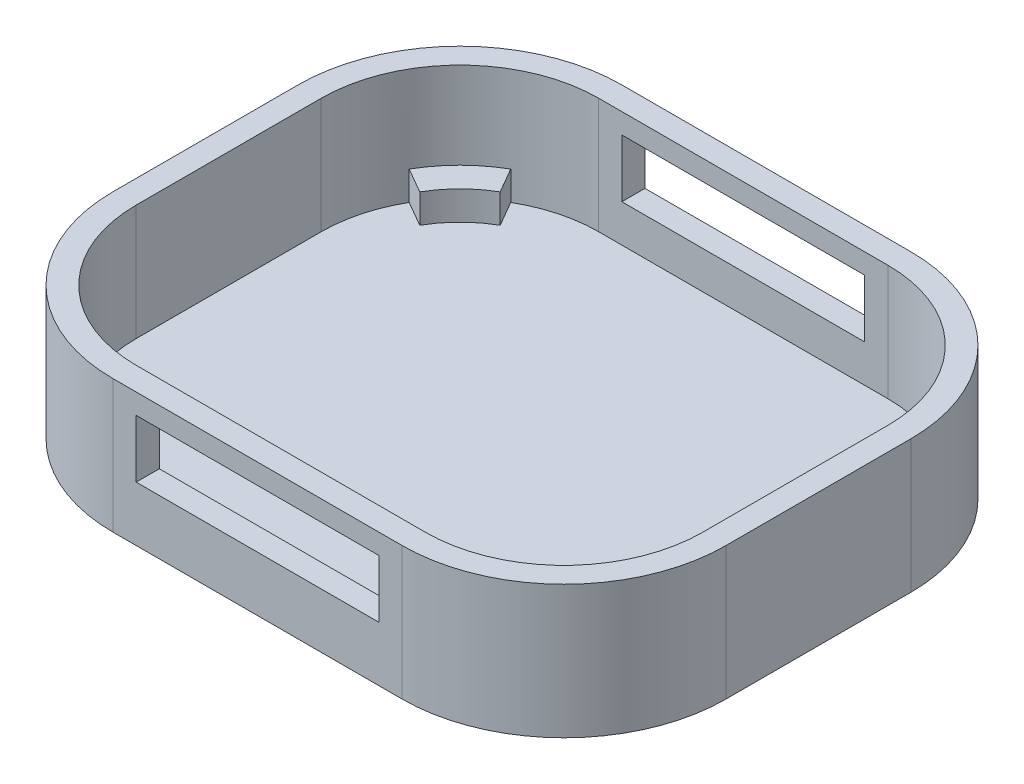
from build123d import *

# Parameters (mm, degrees)
BOSS_EXTRUDE1_DEPTH     = 5.75
CUT_EXTRUDE1_DEPTH      = 50.993124527
CUT_EXTRUDE1_DEPTH_BACK = 50.993124527
SKETCH2_W               = 21
SKETCH2_H               = 5
BOSS_EXTRUDE2_START     = -1.5
BOSS_EXTRUDE2_DEPTH     = 1.5
BOSS_EXTRUDE3_START     = 2.5
BOSS_EXTRUDE3_DEPTH     = 2.5


with BuildPart() as part:
    # Sketch1 → Boss-Extrude1 (new, symmetric)
    with BuildSketch(Plane(origin=(0, 0, 0), x_dir=(1, 0, 0), z_dir=(0, 1, 0))):
        with BuildLine():
            Line((-26.5, 8), (-26.5, -8))
            ThreePointArc((-26.5, -8), (-22.399494937, -17.899494937), (-12.5, -22))
            Line((-12.5, -22), (12.5, -22))
            ThreePointArc((12.5, -22), (22.399494937, -17.899494937), (26.5, -8))
            Line((26.5, -8), (26.5, 8))
            ThreePointArc((26.5, 8), (22.399494937, 17.899494937), (12.5, 22))
            Line((12.5, 22), (-12.5, 22))
            ThreePointArc((-12.5, 22), (-22.399494937, 17.899494937), (-26.5, 8))
        make_face()
        with BuildLine():
            Line((12.5, -20), (-12.5, -20))
            ThreePointArc((-12.5, -20), (-20.985281374, -16.485281374), (-24.5, -8))
            Line((-24.5, -8), (-24.5, 8))
            ThreePointArc((-24.5, 8), (-20.985281374, 16.485281374), (-12.5, 20))
            Line((-12.5, 20), (12.5, 20))
            ThreePointArc((12.5, 20), (20.985281374, 16.485281374), (24.5, 8))
            Line((24.5, 8), (24.5, -8))
            ThreePointArc((24.5, -8), (20.985281374, -16.485281374), (12.5, -20))
        make_face(mode=Mode.SUBTRACT)
    extrude(amount=BOSS_EXTRUDE1_DEPTH, both=True)

    # Sketch2 → Cut-Extrude1 (cut, two sides: drawn at the far end of the back side and taken through both)
    with BuildSketch(Plane.XY.offset(-20).offset(-CUT_EXTRUDE1_DEPTH_BACK)):
        with Locations((0, 1.5)):
            Rectangle(SKETCH2_W, SKETCH2_H)
    extrude(amount=CUT_EXTRUDE1_DEPTH + CUT_EXTRUDE1_DEPTH_BACK, mode=Mode.SUBTRACT)

    # Sketch3 → Boss-Extrude2 (add)
    with BuildSketch(Plane.XZ.offset(5.75).offset(BOSS_EXTRUDE2_START)):
        with BuildLine():
            Line((-12.5, -22), (12.5, -22))
            ThreePointArc((12.5, -22), (22.399494937, -17.899494937), (26.5, -8))
            Line((26.5, -8), (26.5, 8))
            ThreePointArc((26.5, 8), (22.399494937, 17.899494937), (12.5, 22))
            Line((12.5, 22), (-12.5, 22))
            ThreePointArc((-12.5, 22), (-22.399494937, 17.899494937), (-26.5, 8))
            Line((-26.5, 8), (-26.5, -8))
            ThreePointArc((-26.5, -8), (-22.399494937, -17.899494937), (-12.5, -22))
        make_face()
    extrude(amount=BOSS_EXTRUDE2_DEPTH)

    # Sketch6 → Boss-Extrude3 (add)
    with BuildSketch(Plane(origin=(0, -4.25, 0), x_dir=(1, 0, 0), z_dir=(0, 1, 0)).offset(BOSS_EXTRUDE3_START)):
        with BuildLine():
            Line((-22.892304845, 14), (-20.727241336, 12.75))
            ThreePointArc((-20.727241336, 12.75), (-19.217514421, 14.717514421), (-17.25, 16.227241336))
            Line((-17.25, 16.227241336), (-18.5, 18.392304845))
            ThreePointArc((-18.5, 18.392304845), (-20.985281374, 16.485281374), (-22.892304845, 14))
        make_face()
        with BuildLine():
            Line((17.25, 16.227241336), (18.5, 18.392304845))
            ThreePointArc((18.5, 18.392304845), (20.985281374, 16.485281374), (22.892304845, 14))
            Line((22.892304845, 14), (20.727241336, 12.75))
            ThreePointArc((20.727241336, 12.75), (19.217514421, 14.717514421), (17.25, 16.227241336))
        make_face()
        with BuildLine():
            Line((22.892304845, -14), (20.727241336, -12.75))
            ThreePointArc((20.727241336, -12.75), (19.217514421, -14.717514421), (17.25, -16.227241336))
            Line((17.25, -16.227241336), (18.5, -18.392304845))
            ThreePointArc((18.5, -18.392304845), (20.985281374, -16.485281374), (22.892304845, -14))
        make_face()
        with BuildLine():
            Line((-17.25, -16.227241336), (-18.5, -18.392304845))
            ThreePointArc((-18.5, -18.392304845), (-20.985281374, -16.485281374), (-22.892304845, -14))
            Line((-22.892304845, -14), (-20.727241336, -12.75))
            ThreePointArc((-20.727241336, -12.75), (-19.217514421, -14.717514421), (-17.25, -16.227241336))
        make_face()
    extrude(amount=-BOSS_EXTRUDE3_DEPTH)


solid = part.part
